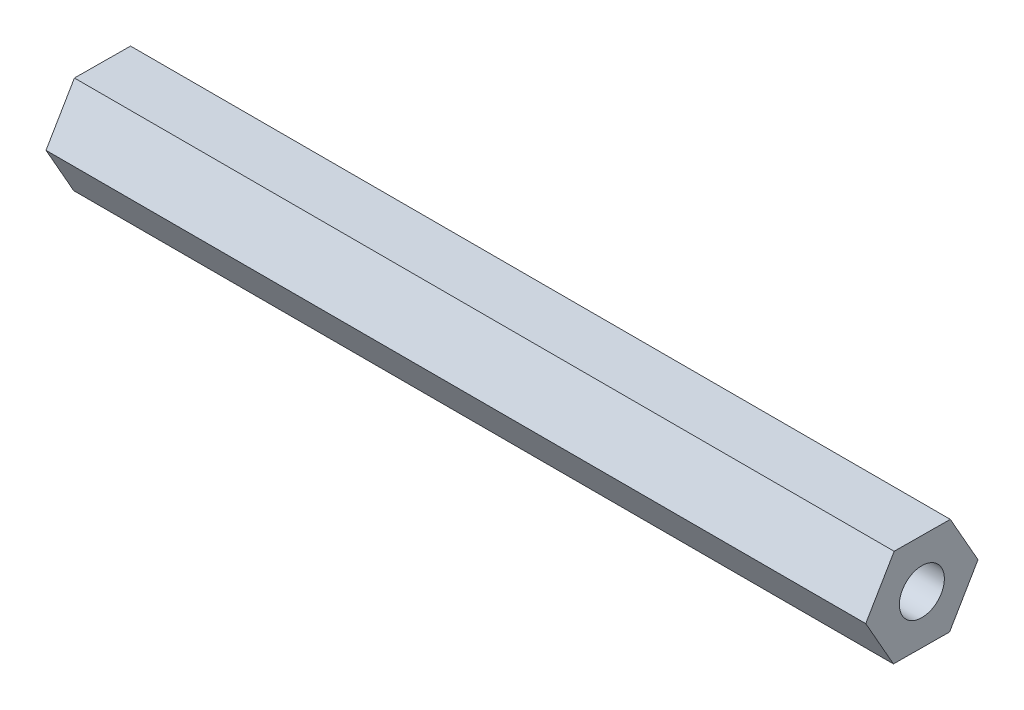
from build123d import *

# Parameters (mm, degrees)
SKETCH1_R           = 1.62
BOSS_EXTRUDE1_DEPTH = 59


with BuildPart() as part:
    # Sketch1 → Boss-Extrude1 (new body)
    with BuildSketch(Plane(origin=(0, 0, 0), x_dir=(0, 0, -1), z_dir=(1, 0, 0))):
        Polygon((1.994629624, -3.513268088), (4.039894227, -0.029234118), (2.045264603, 3.48403397), (-1.994629624, 3.513268088), (-4.039894227, 0.029234118), (-2.045264603, -3.48403397), align=None)
        Circle(SKETCH1_R, mode=Mode.SUBTRACT)
    extrude(amount=BOSS_EXTRUDE1_DEPTH)


solid = part.part
